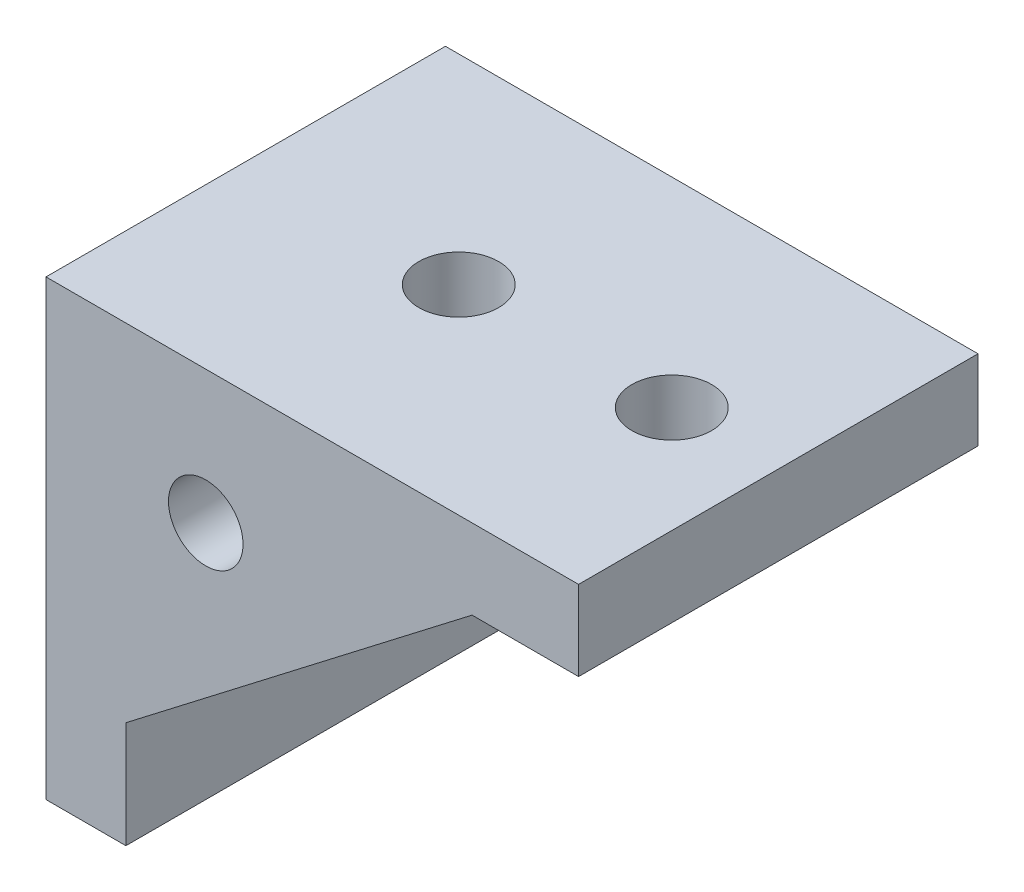
from build123d import *

# Parameters (mm, degrees)
EXTRUDE_1_DEPTH     = 15
SKETCH_2_R          = 1.5
CUT_EXTRUDE_1_DEPTH = 3
SKETCH_3_R          = 1.5
CUT_EXTRUDE_2_DEPTH = 3
EXTRUDE_2_DEPTH     = 2
EXTRUDE_3_DEPTH     = 2
SKETCH_6_R          = 1.4
CUT_EXTRUDE_3_DEPTH = 27.645825189
FILLET_1_R          = 3


with BuildPart() as part:
    # 草图1 → 凸台-拉伸1 (new body)
    with BuildSketch(Plane.XY):
        Polygon((0, -14), (0, 0), (17, 0), (17, 3), (-3, 3), (-3, -14), align=None)
    extrude(amount=EXTRUDE_1_DEPTH)

    # 草图2 → 切除-拉伸1 (cut)
    with BuildSketch(Plane(origin=(0, 0, 0), x_dir=(0, 0, -1), z_dir=(1, 0, 0))):
        with Locations(Location((-7.5, -6, 0), (0, 0, 90))):
            Circle(SKETCH_2_R)
    extrude(amount=-CUT_EXTRUDE_1_DEPTH, mode=Mode.SUBTRACT)

    # 草图3 → 切除-拉伸2 (cut)
    with BuildSketch(Plane.XZ):
        with Locations(Location((13, 7.5, 0), (0, 0, 270))):
            Circle(SKETCH_3_R)
        with Locations(Location((5, 7.5, 0), (0, 0, 270))):
            Circle(SKETCH_3_R)
    extrude(amount=-CUT_EXTRUDE_2_DEPTH, mode=Mode.SUBTRACT)

    # 草图4 → 凸台-拉伸2 (add)
    with BuildSketch(Plane.XY.offset(15)):
        Polygon((0, 0), (0, -10), (13, 0), align=None)
    extrude(amount=-EXTRUDE_2_DEPTH)

    # 草图5 → 凸台-拉伸3 (add)
    with BuildSketch(Plane(origin=(0, 0, 0), x_dir=(-1, 0, 0), z_dir=(0, 0, -1))):
        Polygon((0, 0), (-13, 0), (0, -10), align=None)
    extrude(amount=-EXTRUDE_3_DEPTH)

    # 草图6 → 切除-拉伸3 (cut, through all)
    with BuildSketch(Plane(origin=(0, 0, 0), x_dir=(-1, 0, 0), z_dir=(0, 0, -1))):
        with Locations((-3, -2)):
            Circle(SKETCH_6_R)
    extrude(amount=-CUT_EXTRUDE_3_DEPTH, mode=Mode.SUBTRACT)

    # 圆角1
    fillet_1_edges = [part.edges().sort_by_distance(p)[0] for p in [
        (0, 0, 7.5),
    ]]
    fillet(fillet_1_edges, radius=FILLET_1_R)


solid = part.part
